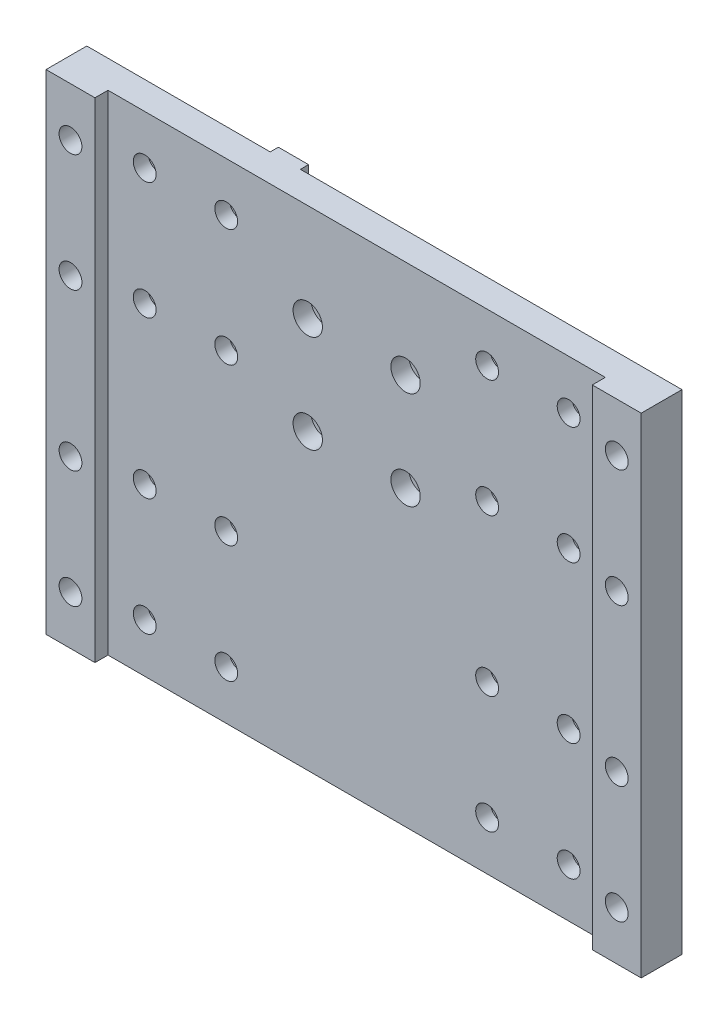
from build123d import *

# Parameters (mm, degrees)
SKETCH1_W                                        = 365
SKETCH1_H                                        = 300
BOSS_EXTRUDE1_DEPTH                              = 30
SKETCH2_W                                        = 234
SKETCH2_H                                        = 300
SKETCH2_W_2                                      = 112.5
CUT_EXTRUDE1_DEPTH                               = 5
SKETCH3_W                                        = 305
SKETCH3_H                                        = 300
CUT_EXTRUDE2_DEPTH                               = 8
CBORE_FOR_M12_SOCKET_HEAD_CAP_SCREW1_D           = 14
CBORE_FOR_M12_SOCKET_HEAD_CAP_SCREW1_CBORE_D     = 20
CBORE_FOR_M12_SOCKET_HEAD_CAP_SCREW1_CBORE_DEPTH = 14
LPATTERN1_COUNT                                  = 2
LPATTERN1_PITCH                                  = 335
CBORE_FOR_M8_SOCKET_HEAD_CAP_SCREW1_D            = 9
CBORE_FOR_M8_SOCKET_HEAD_CAP_SCREW1_CBORE_D      = 14
CBORE_FOR_M8_SOCKET_HEAD_CAP_SCREW1_CBORE_DEPTH  = 9
LPATTERN2_COUNT                                  = 2
LPATTERN2_PITCH                                  = 210
LPATTERN2_COUNT_DIR2                             = 2
LPATTERN2_PITCH_DIR2                             = 168
CBORE_FOR_M10_SOCKET_HEAD_CAP_SCREW1_D           = 12
CBORE_FOR_M10_SOCKET_HEAD_CAP_SCREW1_CBORE_D     = 18
CBORE_FOR_M10_SOCKET_HEAD_CAP_SCREW1_CBORE_DEPTH = 11


with BuildPart() as part:
    # Sketch1 → Boss-Extrude1 (new body)
    with BuildSketch(Plane.XY):
        with Locations((-182.5, 150)):
            Rectangle(SKETCH1_W, SKETCH1_H)
    extrude(amount=-BOSS_EXTRUDE1_DEPTH)

    # Sketch2 → Cut-Extrude1 (cut)
    with BuildSketch(Plane(origin=(0, 0, -30), x_dir=(-1, 0, 0), z_dir=(0, 0, -1))):
        with Locations((117, 150)):
            Rectangle(SKETCH2_W, SKETCH2_H)
        with Locations((308.75, 150)):
            Rectangle(SKETCH2_W_2, SKETCH2_H)
    extrude(amount=-CUT_EXTRUDE1_DEPTH, mode=Mode.SUBTRACT)

    # Sketch3 → Cut-Extrude2 (cut)
    with BuildSketch(Plane.XY):
        with Locations((-182.5, 150)):
            Rectangle(SKETCH3_W, SKETCH3_H)
    extrude(amount=-CUT_EXTRUDE2_DEPTH, mode=Mode.SUBTRACT)

    # CBORE for M12 Socket Head Cap Screw1 (through all)
    with Locations(Plane(origin=(-5.933420532, 68.021379898, -25), x_dir=(1, 0, 0), z_dir=(0, 0, -1))):
        with Locations((-9.066579468, -201.978620102), (-9.066579468, -129.978620102), (-9.066579468, -33.978620102), (-9.066579468, 38.021379898)):
            cbore_for_m12_socket_head_cap_screw1 = CounterBoreHole(CBORE_FOR_M12_SOCKET_HEAD_CAP_SCREW1_D / 2, CBORE_FOR_M12_SOCKET_HEAD_CAP_SCREW1_CBORE_D / 2, CBORE_FOR_M12_SOCKET_HEAD_CAP_SCREW1_CBORE_DEPTH)

    # LPattern1: CBORE for M12 Socket Head Cap Screw1 ×2
    with Locations(*[(-i * LPATTERN1_PITCH, 0, 0) for i in range(1, LPATTERN1_COUNT)]):
        add(cbore_for_m12_socket_head_cap_screw1, mode=Mode.SUBTRACT)

    # CBORE for M8 Socket Head Cap Screw1 (through all)
    with Locations(Plane.XY.offset(-8)):
        with Locations((-52.5, 30), (-52.5, 102), (-102.5, 102), (-102.5, 30)):
            cbore_for_m8_socket_head_cap_screw1 = CounterBoreHole(CBORE_FOR_M8_SOCKET_HEAD_CAP_SCREW1_D / 2, CBORE_FOR_M8_SOCKET_HEAD_CAP_SCREW1_CBORE_D / 2, CBORE_FOR_M8_SOCKET_HEAD_CAP_SCREW1_CBORE_DEPTH)

    # LPattern2: CBORE for M8 Socket Head Cap Screw1 2 × 2
    with Locations(*[(-i * LPATTERN2_PITCH, j * LPATTERN2_PITCH_DIR2, 0) for i in range(LPATTERN2_COUNT) for j in range(LPATTERN2_COUNT_DIR2) if (i, j) != (0, 0)]):
        add(cbore_for_m8_socket_head_cap_screw1, mode=Mode.SUBTRACT)

    # CBORE for M10 Socket Head Cap Screw1 (through all)
    with Locations(Plane.XY.offset(-8)):
        with Locations((-152.5, 240), (-152.5, 180), (-212.5, 180), (-212.5, 240)):
            CounterBoreHole(CBORE_FOR_M10_SOCKET_HEAD_CAP_SCREW1_D / 2, CBORE_FOR_M10_SOCKET_HEAD_CAP_SCREW1_CBORE_D / 2, CBORE_FOR_M10_SOCKET_HEAD_CAP_SCREW1_CBORE_DEPTH)


solid = part.part
